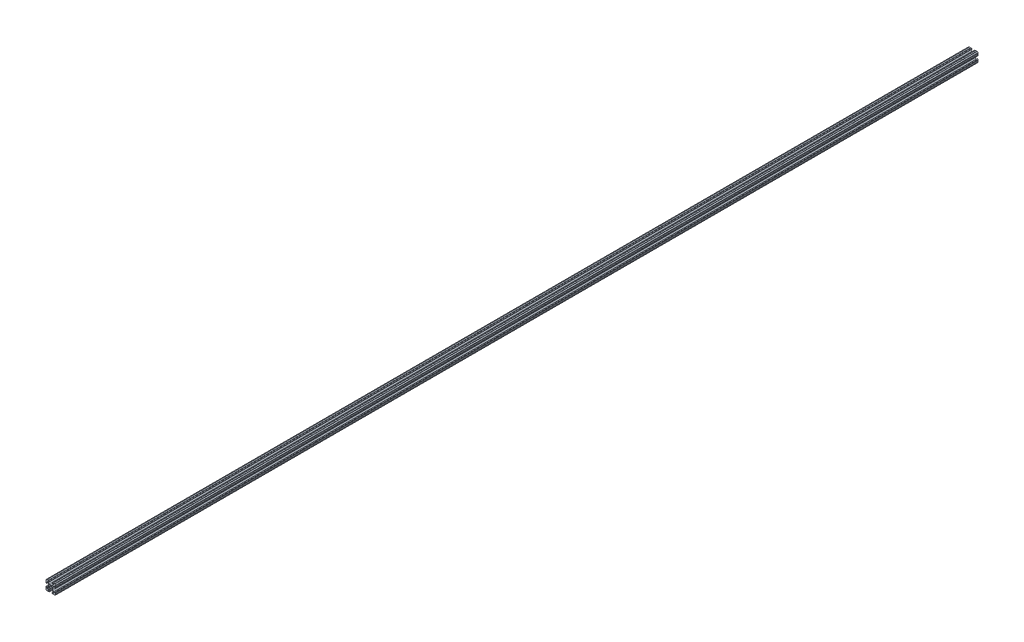
from build123d import *

# Parameters (mm, degrees)
SKETCH1_R           = 2.6035
BOSS_EXTRUDE1_DEPTH = 2438.4


with BuildPart() as part:
    # Sketch1 → Boss-Extrude1 (new body)
    with BuildSketch(Plane(origin=(0, 0, -101.6), x_dir=(-1, 0, 0), z_dir=(0, 0, -1))):
        with BuildLine():
            Line((12.7, -9.5504), (12.7, -6.3330836))
            ThreePointArc((12.7, -6.3330836), (12.192, -5.8250836), (12.7, -5.3170836))
            Line((12.7, -5.3170836), (12.7, -4.3434))
            ThreePointArc((12.7, -4.3434), (11.5951, -3.2385), (10.4902, -4.3434))
            Line((10.4902, -4.3434), (10.4902, -6.474794456))
            ThreePointArc((10.4902, -6.474794456), (9.863006367, -7.413456061), (8.75577951, -7.193214945))
            Line((8.75577951, -7.193214945), (5.42573597, -3.863171405))
            ThreePointArc((5.42573597, -3.863171405), (4.737482484, -2.833127272), (4.4958, -1.618107374))
            Line((4.4958, -1.618107374), (4.4958, 1.618107374))
            ThreePointArc((4.4958, 1.618107374), (4.737482484, 2.833127272), (5.42573597, 3.863171405))
            Line((5.42573597, 3.863171405), (8.75577951, 7.193214945))
            ThreePointArc((8.75577951, 7.193214945), (9.863006367, 7.413456061), (10.4902, 6.474794456))
            Line((10.4902, 6.474794456), (10.4902, 4.343399971))
            ThreePointArc((10.4902, 4.343399971), (11.5951, 3.238499971), (12.7, 4.343399971))
            Line((12.7, 4.343399971), (12.7, 5.3170836))
            ThreePointArc((12.7, 5.3170836), (12.192, 5.8250836), (12.7, 6.3330836))
            Line((12.7, 6.3330836), (12.7, 9.5504))
            ThreePointArc((12.7, 9.5504), (12.192000006, 10.058323491), (12.699846982, 10.566399977))
            ThreePointArc((12.699846982, 10.566399977), (12.082522516, 12.082522516), (10.566399977, 12.699846982))
            ThreePointArc((10.566399977, 12.699846982), (10.058323491, 12.192000006), (9.5504, 12.7))
            Line((9.5504, 12.7), (6.3330836, 12.7))
            ThreePointArc((6.3330836, 12.7), (5.8250836, 12.192), (5.3170836, 12.7))
            Line((5.3170836, 12.7), (4.3434, 12.7))
            ThreePointArc((4.3434, 12.7), (3.2385, 11.5951), (4.3434, 10.4902))
            Line((4.3434, 10.4902), (6.474794456, 10.4902))
            ThreePointArc((6.474794456, 10.4902), (7.413456061, 9.863006367), (7.193214945, 8.75577951))
            Line((7.193214945, 8.75577951), (3.863171405, 5.42573597))
            ThreePointArc((3.863171405, 5.42573597), (2.833127272, 4.737482484), (1.618107374, 4.4958))
            Line((1.618107374, 4.4958), (-1.618107374, 4.4958))
            ThreePointArc((-1.618107374, 4.4958), (-2.833127272, 4.737482484), (-3.863171405, 5.42573597))
            Line((-3.863171405, 5.42573597), (-7.193214945, 8.75577951))
            ThreePointArc((-7.193214945, 8.75577951), (-7.413456061, 9.863006367), (-6.474794456, 10.4902))
            Line((-6.474794456, 10.4902), (-4.343399971, 10.4902))
            ThreePointArc((-4.343399971, 10.4902), (-3.238499971, 11.5951), (-4.343399971, 12.7))
            Line((-4.343399971, 12.7), (-5.3170836, 12.7))
            ThreePointArc((-5.3170836, 12.7), (-5.8250836, 12.192), (-6.3330836, 12.7))
            Line((-6.3330836, 12.7), (-9.5504, 12.7))
            ThreePointArc((-9.5504, 12.7), (-10.058323491, 12.192000006), (-10.566399977, 12.699846982))
            ThreePointArc((-10.566399977, 12.699846982), (-12.082522516, 12.082522516), (-12.699846982, 10.566399977))
            ThreePointArc((-12.699846982, 10.566399977), (-12.192000006, 10.058323491), (-12.7, 9.5504))
            Line((-12.7, 9.5504), (-12.7, 6.3330836))
            ThreePointArc((-12.7, 6.3330836), (-12.192, 5.8250836), (-12.7, 5.3170836))
            Line((-12.7, 5.3170836), (-12.7, 4.3434))
            ThreePointArc((-12.7, 4.3434), (-11.5951, 3.2385), (-10.4902, 4.3434))
            Line((-10.4902, 4.3434), (-10.4902, 6.474794456))
            ThreePointArc((-10.4902, 6.474794456), (-9.863006367, 7.413456061), (-8.75577951, 7.193214945))
            Line((-8.75577951, 7.193214945), (-5.42573597, 3.863171405))
            ThreePointArc((-5.42573597, 3.863171405), (-4.737482484, 2.833127272), (-4.4958, 1.618107374))
            Line((-4.4958, 1.618107374), (-4.4958, -1.618107374))
            ThreePointArc((-4.4958, -1.618107374), (-4.737482484, -2.833127272), (-5.42573597, -3.863171405))
            Line((-5.42573597, -3.863171405), (-8.75577951, -7.193214945))
            ThreePointArc((-8.75577951, -7.193214945), (-9.863006367, -7.413456061), (-10.4902, -6.474794456))
            Line((-10.4902, -6.474794456), (-10.4902, -4.343399971))
            ThreePointArc((-10.4902, -4.343399971), (-11.5951, -3.238499971), (-12.7, -4.343399971))
            Line((-12.7, -4.343399971), (-12.7, -5.3170836))
            ThreePointArc((-12.7, -5.3170836), (-12.192, -5.8250836), (-12.7, -6.3330836))
            Line((-12.7, -6.3330836), (-12.7, -9.5504))
            ThreePointArc((-12.7, -9.5504), (-12.192000006, -10.058323491), (-12.699846982, -10.566399977))
            ThreePointArc((-12.699846982, -10.566399977), (-12.082522516, -12.082522516), (-10.566399977, -12.699846982))
            ThreePointArc((-10.566399977, -12.699846982), (-10.058323491, -12.192000006), (-9.5504, -12.7))
            Line((-9.5504, -12.7), (-6.3330836, -12.7))
            ThreePointArc((-6.3330836, -12.7), (-5.8250836, -12.192), (-5.3170836, -12.7))
            Line((-5.3170836, -12.7), (-4.3434, -12.7))
            ThreePointArc((-4.3434, -12.7), (-3.2385, -11.5951), (-4.3434, -10.4902))
            Line((-4.3434, -10.4902), (-6.474794456, -10.4902))
            ThreePointArc((-6.474794456, -10.4902), (-7.413456061, -9.863006367), (-7.193214945, -8.75577951))
            Line((-7.193214945, -8.75577951), (-3.863171405, -5.42573597))
            ThreePointArc((-3.863171405, -5.42573597), (-2.833127272, -4.737482484), (-1.618107374, -4.4958))
            Line((-1.618107374, -4.4958), (1.618107374, -4.4958))
            ThreePointArc((1.618107374, -4.4958), (2.833127272, -4.737482484), (3.863171405, -5.42573597))
            Line((3.863171405, -5.42573597), (7.193214945, -8.75577951))
            ThreePointArc((7.193214945, -8.75577951), (7.413456061, -9.863006367), (6.474794456, -10.4902))
            Line((6.474794456, -10.4902), (4.343399971, -10.4902))
            ThreePointArc((4.343399971, -10.4902), (3.238499971, -11.5951), (4.343399971, -12.7))
            Line((4.343399971, -12.7), (5.3170836, -12.7))
            ThreePointArc((5.3170836, -12.7), (5.8250836, -12.192), (6.3330836, -12.7))
            Line((6.3330836, -12.7), (9.5504, -12.7))
            ThreePointArc((9.5504, -12.7), (10.058323491, -12.192000006), (10.566399977, -12.699846982))
            ThreePointArc((10.566399977, -12.699846982), (12.082522516, -12.082522516), (12.699846982, -10.566399977))
            ThreePointArc((12.699846982, -10.566399977), (12.192000006, -10.058323491), (12.7, -9.5504))
        make_face()
        Circle(SKETCH1_R, mode=Mode.SUBTRACT)
    extrude(amount=-BOSS_EXTRUDE1_DEPTH)


solid = part.part
